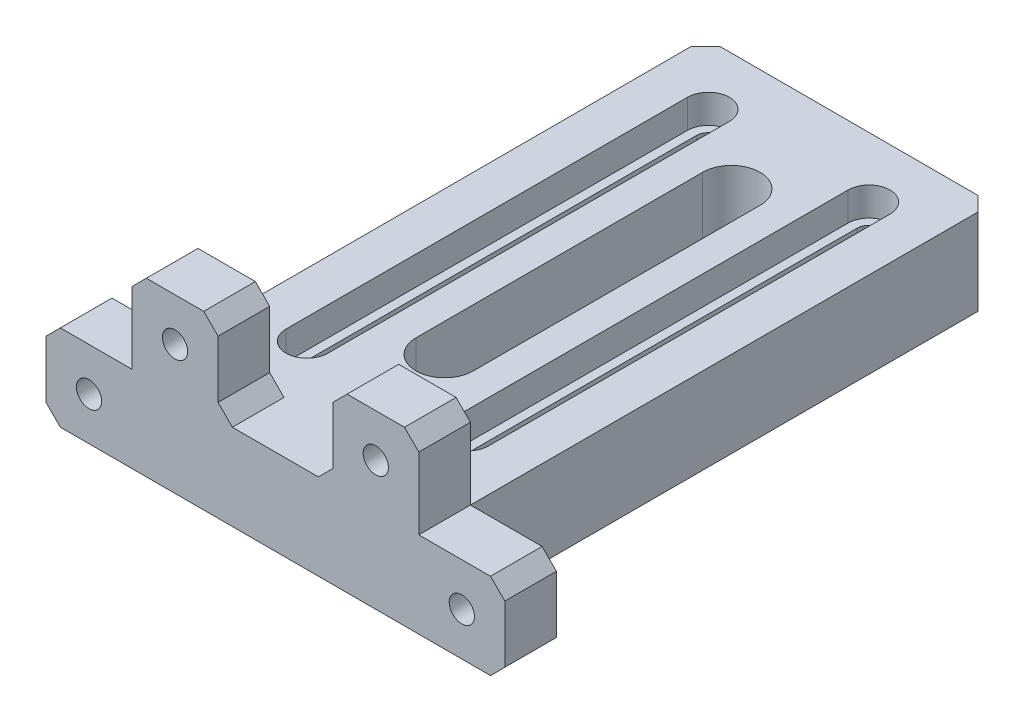
from build123d import *

# Parameters (mm, degrees)
SKETCH1_R           = 2.2
BOSS_EXTRUDE1_DEPTH = 100
SKETCH5_W           = 15
SKETCH5_H           = 15
SKETCH5_R           = 2.2
CUT_EXTRUDE2_DEPTH  = 91
CUT_EXTRUDE3_DEPTH  = 112.803398875
LPATTERN1_COUNT     = 2
LPATTERN1_PITCH     = 35
CUT_EXTRUDE4_DEPTH  = 5
CHAMFER1_SIZE       = 2.5


with BuildPart() as part:
    # Sketch1 → Boss-Extrude1 (new body)
    with BuildSketch(Plane.XY):
        Polygon((-25, 22.5), (-25, 7.5), (-40, 7.5), (-40, -7.5), (40, -7.5), (40, 7.5), (25, 7.5), (25, 22.5), (10, 22.5), (10, 7.5), (-10, 7.5), (-10, 22.5), align=None)
        with Locations((-17.5, 15)):
            Circle(SKETCH1_R, mode=Mode.SUBTRACT)
        with Locations((-32.5, 0)):
            Circle(SKETCH1_R, mode=Mode.SUBTRACT)
        with Locations((17.5, 15)):
            Circle(SKETCH1_R, mode=Mode.SUBTRACT)
        with Locations((32.5, 0)):
            Circle(SKETCH1_R, mode=Mode.SUBTRACT)
    extrude(amount=BOSS_EXTRUDE1_DEPTH)

    # Sketch5 → Cut-Extrude2 (cut)
    # profile 1 of 4: a face of its own
    with BuildSketch(Plane(origin=(0, 0, 0), x_dir=(-1, 0, 0), z_dir=(0, 0, -1))):
        with Locations((-32.5, 0)):
            Rectangle(SKETCH5_W, SKETCH5_H)
        with Locations(Location((-32.5, 0, 0), (0, 0, 180))):
            Circle(SKETCH5_R, mode=Mode.SUBTRACT)
    # profile 2 of 4: a face of its own
    with BuildSketch(Plane(origin=(0, 0, 0), x_dir=(-1, 0, 0), z_dir=(0, 0, -1))):
        with Locations((-17.5, 15)):
            Rectangle(SKETCH5_W, SKETCH5_H)
        with Locations(Location((-17.5, 15, 0), (0, 0, 180))):
            Circle(SKETCH5_R, mode=Mode.SUBTRACT)
    # profile 3 of 4: a face of its own
    with BuildSketch(Plane(origin=(0, 0, 0), x_dir=(-1, 0, 0), z_dir=(0, 0, -1))):
        with Locations((17.5, 15)):
            Rectangle(SKETCH5_W, SKETCH5_H)
        with Locations(Location((17.5, 15, 0), (0, 0, 180))):
            Circle(SKETCH5_R, mode=Mode.SUBTRACT)
    # profile 4 of 4: a face of its own
    with BuildSketch(Plane(origin=(0, 0, 0), x_dir=(-1, 0, 0), z_dir=(0, 0, -1))):
        with Locations((32.5, 0)):
            Rectangle(SKETCH5_W, SKETCH5_H)
        with Locations(Location((32.5, 0, 0), (0, 0, 180))):
            Circle(SKETCH5_R, mode=Mode.SUBTRACT)
    extrude(amount=-CUT_EXTRUDE2_DEPTH, mode=Mode.SUBTRACT)

    # Sketch6 → Cut-Extrude3 (cut, through all)
    with BuildSketch(Plane.XZ.offset(7.5)):
        with BuildLine():
            Line((5, 70.5), (5, 20.5))
            ThreePointArc((5, 20.5), (0, 15.5), (-5, 20.5))
            Line((-5, 20.5), (-5, 70.5))
            ThreePointArc((-5, 70.5), (0, 75.5), (5, 70.5))
        make_face()
        with BuildLine():
            Line((-11.9, 80.5), (-11.9, 10.5))
            ThreePointArc((-11.9, 10.5), (-14, 8.4), (-16.1, 10.5))
            Line((-16.1, 10.5), (-16.1, 80.5))
            ThreePointArc((-16.1, 80.5), (-14, 82.6), (-11.9, 80.5))
        make_face()
        with BuildLine():
            Line((11.9, 80.5), (11.9, 10.5))
            ThreePointArc((11.9, 10.5), (14, 8.4), (16.1, 10.5))
            Line((16.1, 10.5), (16.1, 80.5))
            ThreePointArc((16.1, 80.5), (14, 82.6), (11.9, 80.5))
        make_face()
    extrude(amount=-CUT_EXTRUDE3_DEPTH, mode=Mode.SUBTRACT)

    # Sketch2 → Cut-Revolve1 (revolve, cut)
    with BuildSketch(Plane(origin=(0, 15, 0), x_dir=(1, 0, 0), z_dir=(0, 1, 0)), mode=Mode.PRIVATE) as cut_revolve1_sk:
        Polygon((-17.5, -91), (-17.5, -94), (-15.3, -94), (-12.692139787, -91), align=None)
    cut_revolve1 = revolve(cut_revolve1_sk.sketch.rotate(Axis((-17.5, 15, 91), (0, 0, 1)), 180), axis=Axis((-17.5, 15, 91), (0, 0, 1)), mode=Mode.SUBTRACT)

    # LPattern1: Cut-Revolve1 ×2
    with Locations(*[(i * LPATTERN1_PITCH, 0, 0) for i in range(1, LPATTERN1_COUNT)]):
        add(cut_revolve1, mode=Mode.SUBTRACT)

    # Sketch8 → Cut-Revolve2 (revolve, cut)
    with BuildSketch(Plane.ZY.offset(32.5)):
        Polygon((91, 0), (94, 0), (94, 2.2), (91, 4.807860213), align=None)
    cut_revolve2 = revolve(axis=Axis((-32.5, 0, 91), (0, 0, 1)), mode=Mode.SUBTRACT)

    # Mirror3: Cut-Revolve2 across plane
    add(cut_revolve2.mirror(Plane(origin=(0, 0, 0), x_dir=(0, 0, 1), z_dir=(1, 0, 0))), mode=Mode.SUBTRACT)

    # Sketch7 → Cut-Extrude4 (cut)
    with BuildSketch(Plane(origin=(0, 7.5, 0), x_dir=(1, 0, 0), z_dir=(0, 1, 0))):
        with BuildLine():
            Line((-10.35, -10.5), (-10.35, -80.5))
            ThreePointArc((-10.35, -80.5), (-14, -84.15), (-17.65, -80.5))
            Line((-17.65, -80.5), (-17.65, -10.5))
            ThreePointArc((-17.65, -10.5), (-14, -6.85), (-10.35, -10.5))
        make_face()
        with BuildLine():
            Line((10.35, -10.5), (10.35, -80.5))
            ThreePointArc((10.35, -80.5), (14, -84.15), (17.65, -80.5))
            Line((17.65, -80.5), (17.65, -10.5))
            ThreePointArc((17.65, -10.5), (14, -6.85), (10.35, -10.5))
        make_face()
    extrude(amount=-CUT_EXTRUDE4_DEPTH, mode=Mode.SUBTRACT)

    # Chamfer1
    chamfer1_edges = [part.edges().sort_by_distance(p)[0] for p in [
        (-25, 0, 0),
        (25, 0, 0),
        (-25, 22.5, 95.5),
        (-10, 22.5, 95.5),
        (-10, 7.5, 95.5),
        (10, 7.5, 95.5),
        (10, 22.5, 95.5),
        (25, 22.5, 95.5),
        (40, 7.5, 95.5),
        (40, -7.5, 95.5),
        (-40, -7.5, 95.5),
        (-40, 7.5, 95.5),
    ]]
    chamfer(chamfer1_edges, length=CHAMFER1_SIZE)


solid = part.part
